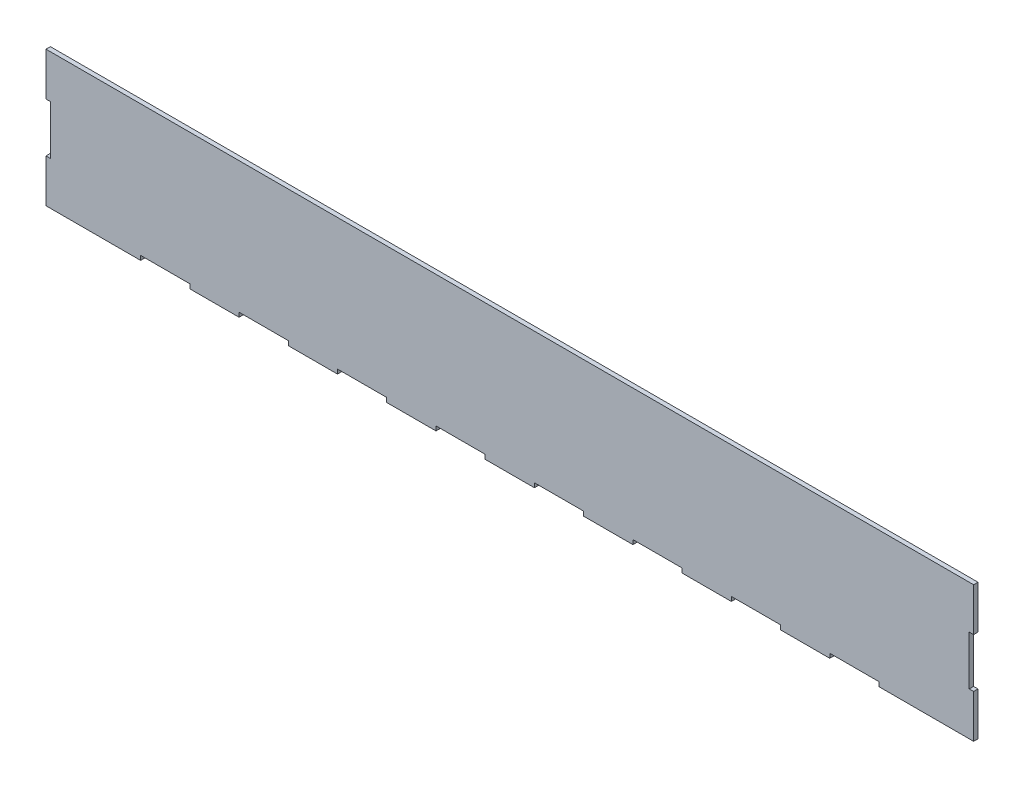
from build123d import *

# Parameters (mm, degrees)
BOSS_EXTRUDE1_DEPTH = 3


with BuildPart() as part:
    # Model → Boss-Extrude1 (new body)
    with BuildSketch(Plane.XY):
        Polygon((0, 192), (0, 162.375), (3, 162.375), (3, 128.625), (0, 128.625), (0, 99), (64.875, 99), (64.875, 102), (98.625, 102), (98.625, 99), (132.375, 99), (132.375, 102), (166.125, 102), (166.125, 99), (199.875, 99), (199.875, 102), (233.625, 102), (233.625, 99), (267.375, 99), (267.375, 102), (301.125, 102), (301.125, 99), (334.875, 99), (334.875, 102), (368.625, 102), (368.625, 99), (402.375, 99), (402.375, 102), (436.125, 102), (436.125, 99), (469.875, 99), (469.875, 102), (503.625, 102), (503.625, 99), (537.375, 99), (537.375, 102), (571.125, 102), (571.125, 99), (604.875, 99), (636, 99), (636, 128.625), (633, 128.625), (633, 162.375), (636, 162.375), (636, 192), align=None)
    extrude(amount=BOSS_EXTRUDE1_DEPTH)


solid = part.part
